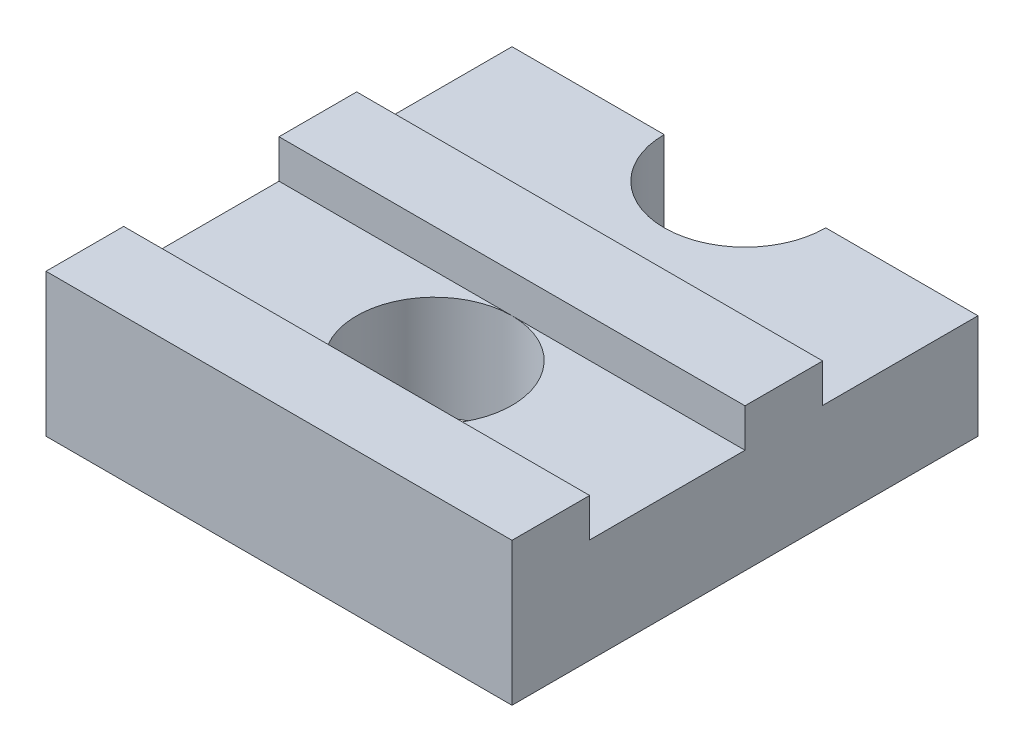
from build123d import *

# Parameters (mm, degrees)
SKETCH1_W           = 9.525
SKETCH1_H           = 9.525
BOSS_EXTRUDE1_DEPTH = 2.921
SKETCH2_W           = 9.525
SKETCH2_H           = 3.175
CUT_EXTRUDE1_DEPTH  = 0.7874
SKETCH3_R           = 1.5875
CUT_EXTRUDE2_DEPTH  = 8.065059197


with BuildPart() as part:
    # Sketch1 → Boss-Extrude1 (new body)
    with BuildSketch(Plane(origin=(0, 0, 0), x_dir=(1, 0, 0), z_dir=(0, 1, 0))):
        Rectangle(SKETCH1_W, SKETCH1_H)
    extrude(amount=BOSS_EXTRUDE1_DEPTH)

    # Sketch2 → Cut-Extrude1 (cut)
    with BuildSketch(Plane(origin=(0, 2.921, 0), x_dir=(1, 0, 0), z_dir=(0, 1, 0))):
        with Locations((0, -1.5875)):
            Rectangle(SKETCH2_W, SKETCH2_H)
        with Locations((0, 3.175)):
            Rectangle(SKETCH2_W, SKETCH2_H)
    extrude(amount=-CUT_EXTRUDE1_DEPTH, mode=Mode.SUBTRACT)

    # Sketch3 → Cut-Extrude2 (cut, through all)
    with BuildSketch(Plane(origin=(0, 2.1336, 0), x_dir=(1, 0, 0), z_dir=(0, 1, 0))):
        with Locations(Location((0, -1.5875, 0), (0, 0, 270))):
            Circle(SKETCH3_R)
        with BuildLine():
            Line((-1.651, 4.7625), (1.651, 4.7625))
            ThreePointArc((1.651, 4.7625), (0, 3.1115), (-1.651, 4.7625))
        make_face()
    extrude(amount=-CUT_EXTRUDE2_DEPTH, mode=Mode.SUBTRACT)


solid = part.part
